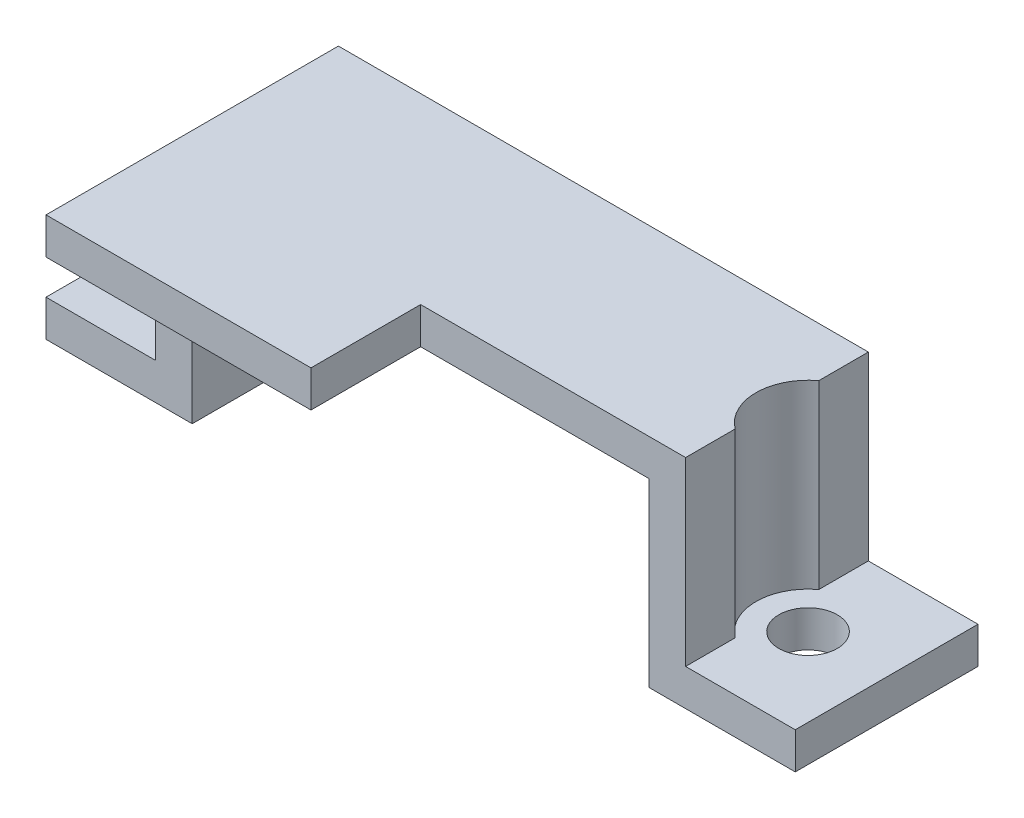
from build123d import *

# Parameters (mm, degrees)
MOUNT_DEPTH            = 10
IZIM5_W                = 14.5
IZIM5_H                = 2
MOTOR_ST_DEPTH         = 6
C_VATA_START           = -2
IZIM6_R                = 1.6
C_VATA_DELIKLERI_DEPTH = 6
IZIM7_R                = 2.85
KES_EKSTR_ZYON1_DEPTH  = 9.9


with BuildPart() as part:
    # Çizim4 → mount (new body)
    with BuildSketch(Plane.XY):
        Polygon((-20, 2.1), (-14, 2.1), (-14, 12), (15, 12), (15, 2.1), (21, 2.1), (21, 0.1), (13, 0.1), (13, 10), (-12, 10), (-12, 0.1), (-20, 0.1), align=None)
    extrude(amount=MOUNT_DEPTH)

    # Çizim5 → motor üstü (add)
    with BuildSketch(Plane.XY.offset(10)):
        with Locations((-6.75, 11)):
            Rectangle(IZIM5_W, IZIM5_H)
    extrude(amount=MOTOR_ST_DEPTH)

    # Çizim6 → cıvata delikleri (cut)
    with BuildSketch(Plane(origin=(0, 2.1, 0), x_dir=(1, 0, 0), z_dir=(0, 1, 0)).offset(C_VATA_START)):
        with Locations(Location((-17, -5, 0), (0, 0, 270))):
            Circle(IZIM6_R)
        with Locations(Location((16.7, -5, 0), (0, 0, 180))):
            Circle(IZIM6_R)
    extrude(amount=C_VATA_DELIKLERI_DEPTH, mode=Mode.SUBTRACT)

    # Çizim7 → Kes-Ekstrüzyon1 (cut)
    with BuildSketch(Plane(origin=(0, 2.1, 0), x_dir=(1, 0, 0), z_dir=(0, 1, 0))):
        with Locations((16.7, -5)):
            Circle(IZIM7_R)
    extrude(amount=KES_EKSTR_ZYON1_DEPTH, mode=Mode.SUBTRACT)


solid = part.part
